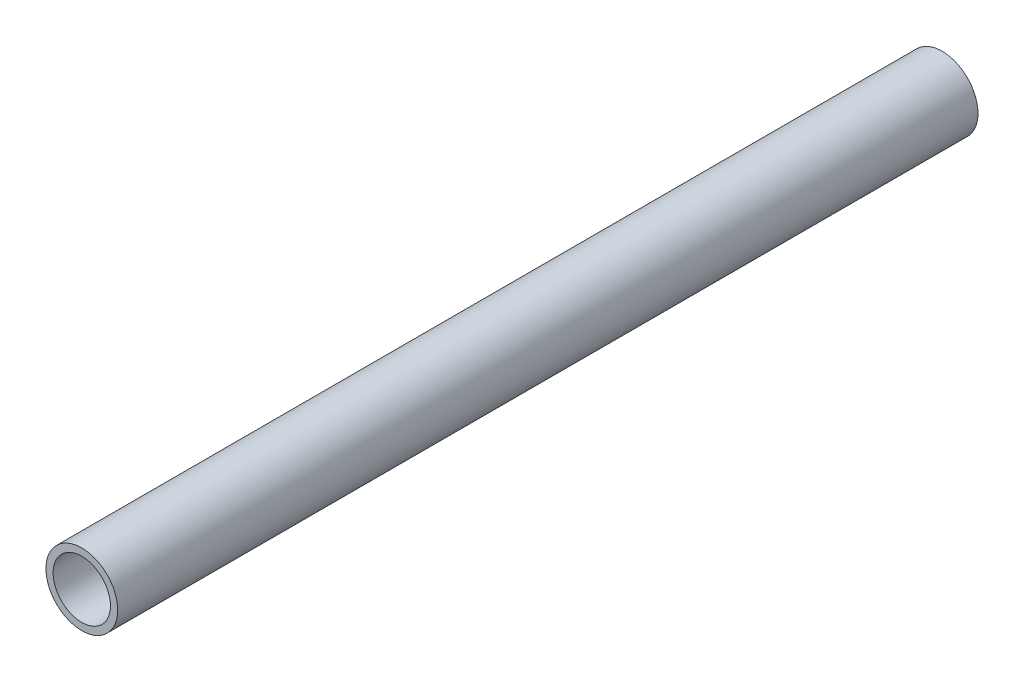
from build123d import *

# Parameters (mm, degrees)
SKETCH_2_R          = 25
EXTRUDE_1_DEPTH     = 600
SKETCH_3_R          = 20
CUT_EXTRUDE_1_DEPTH = 600


with BuildPart() as part:
    # 草图2 → 凸台-拉伸1 (new body)
    with BuildSketch(Plane.XY):
        Circle(SKETCH_2_R)
    extrude(amount=EXTRUDE_1_DEPTH)

    # 草图3 → 切除-拉伸1 (cut)
    with BuildSketch(Plane.XY.offset(600)):
        Circle(SKETCH_3_R)
    extrude(amount=-CUT_EXTRUDE_1_DEPTH, mode=Mode.SUBTRACT)


solid = part.part
